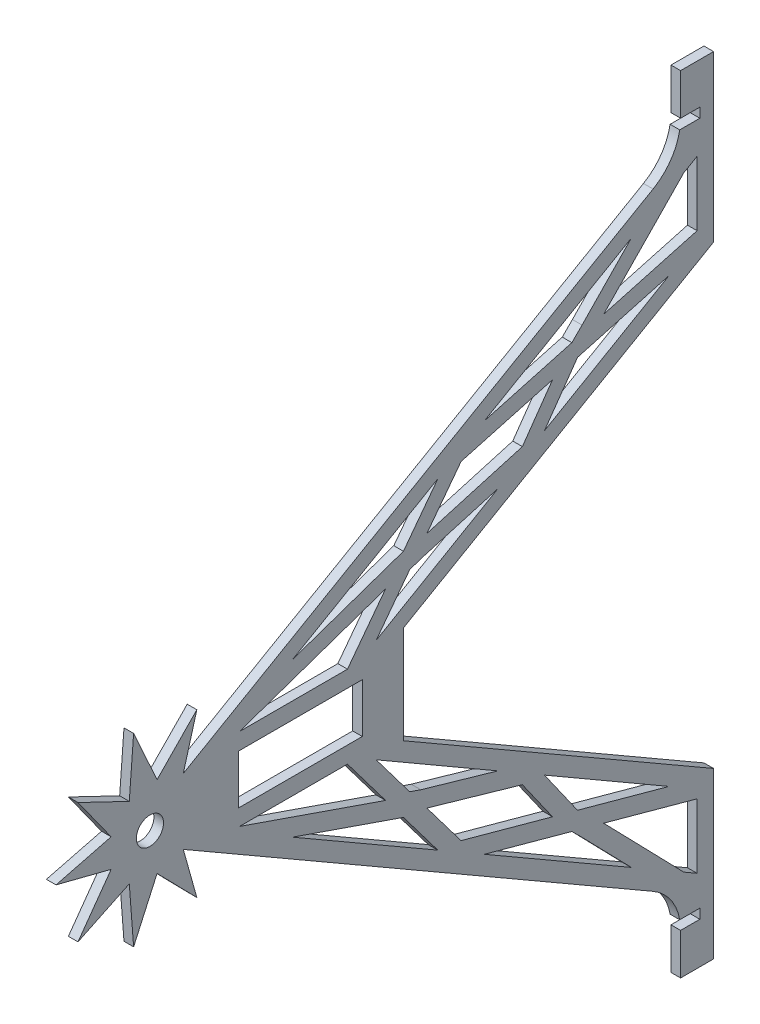
from build123d import *

# Parameters (mm, degrees)
SKETCH1_R               = 4.95
SKETCH1_W               = 17.9
SKETCH1_H               = 45.1
BOSS_EXTRUDE1_DEPTH     = 3.5
CUT_EXTRUDE1_DEPTH      = 251.796682357
CUT_EXTRUDE1_DEPTH_BACK = 251.796682357
SKETCH2_W               = 258.160615752
SKETCH2_H               = 10
SKETCH3_W               = 12
SKETCH3_H               = 60
BOSS_EXTRUDE2_DEPTH     = 3.5
FILLET1_R               = 20
BOSS_EXTRUDE3_START     = -3.5
BOSS_EXTRUDE3_DEPTH     = 3.5
CIRPATTERN1_COUNT       = 9
SKETCH5_W               = 17
SKETCH5_H               = 3.5
CUT_EXTRUDE2_DEPTH      = 250.910895112
CUT_EXTRUDE3_DEPTH      = 250.910895112


with BuildPart() as part:
    # Sketch1 → Boss-Extrude1 (new body)
    with BuildSketch(Plane.YZ):
        with BuildLine():
            Line((-10.899695646, -10.305175148), (-129.080307876, -215))
            Line((-129.080307876, -215), (-88.665789032, -215))
            Line((-88.665789032, -215), (-17.790269987, -92.24))
            Line((-17.790269987, -92.24), (17.790269987, -92.24))
            Line((17.790269987, -92.24), (88.665789032, -215))
            Line((88.665789032, -215), (129.080307876, -215))
            Line((129.080307876, -215), (10.899695646, -10.305175148))
            ThreePointArc((10.899695646, -10.305175148), (0, 15), (-10.899695646, -10.305175148))
        make_face()
        Circle(SKETCH1_R, mode=Mode.SUBTRACT)
        with Locations((0, -54.69)):
            Rectangle(SKETCH1_W, SKETCH1_H, mode=Mode.SUBTRACT)
    extrude(amount=BOSS_EXTRUDE1_DEPTH)

    # Sketch2 → Cut-Extrude1 (cut, two sides: drawn at the far end of the back side and taken through both)
    with BuildSketch(Plane.YZ.offset(3.5).offset(-CUT_EXTRUDE1_DEPTH_BACK)):
        with Locations((0, -210)):
            Rectangle(SKETCH2_W, SKETCH2_H)
    extrude(amount=CUT_EXTRUDE1_DEPTH + CUT_EXTRUDE1_DEPTH_BACK, mode=Mode.SUBTRACT)

    # Sketch3 → Boss-Extrude2 (add)
    with BuildSketch(Plane(origin=(3.5, 0, 0), x_dir=(0, 0, -1), z_dir=(1, 0, 0))):
        with Locations((199, -112.892286341)):
            Rectangle(SKETCH3_W, SKETCH3_H)
        with Locations((199, 112.892286341)):
            Rectangle(SKETCH3_W, SKETCH3_H)
    extrude(amount=-BOSS_EXTRUDE2_DEPTH)

    # Fillet1
    fillet1_edges = [part.edges().sort_by_distance(p)[0] for p in [
        (1.75, 116.378601954, -193),
        (1.75, -116.378601954, -193),
    ]]
    fillet(fillet1_edges, radius=FILLET1_R)

    # Sketch4 → Boss-Extrude3 (add)
    with BuildSketch(Plane(origin=(3.5, 0, 0), x_dir=(0, 0, -1), z_dir=(1, 0, 0)).offset(BOSS_EXTRUDE3_START)):
        with BuildLine():
            Line((-34.137962787, 0), (-14.095389312, -5.13030215))
            ThreePointArc((-14.095389312, -5.13030215), (-15, 0), (-14.095389312, 5.13030215))
            Line((-14.095389312, 5.13030215), (-34.137962787, 0))
        make_face()
    boss_extrude3 = extrude(amount=BOSS_EXTRUDE3_DEPTH)

    # CirPattern1: Boss-Extrude3 ×9 about axis
    cirpattern1_axis = Axis((-0.1751615, 0, 0), (1, 0, 0))
    for i in range(1, CIRPATTERN1_COUNT):
        add(boss_extrude3.rotate(cirpattern1_axis, i * 360 / CIRPATTERN1_COUNT))

    # Sketch5 → Cut-Extrude2 (cut, symmetric)
    with BuildSketch(Plane(origin=(3.5, 0, 0), x_dir=(0, 0, -1), z_dir=(1, 0, 0))):
        with Locations((191.5, -126.142286341)):
            Rectangle(SKETCH5_W, SKETCH5_H)
    cut_extrude2 = extrude(amount=CUT_EXTRUDE2_DEPTH, both=True, mode=Mode.SUBTRACT)

    # Mirror1: Cut-Extrude2 across plane
    add(cut_extrude2.mirror(Plane.ZX), mode=Mode.SUBTRACT)

    # Sketch6 → Cut-Extrude3 (cut, symmetric)
    with BuildSketch(Plane.YZ.offset(3.5)):
        Polygon((-44.440620352, -126.565865893), (-18.81339339, -82.279763058), (-34.966746745, -94.476691336), (-36.374058239, -98.54606889), align=None)
        Polygon((-33.320603167, -85.715441185), (-14.95, -71.844331927), (-14.95, -32.59506202), align=None)
        Polygon((-80.442842118, -188.780872527), (-54.234238638, -143.490099921), (-71.318419935, -155.512353255), align=None)
        Polygon((-41.912952433, -92.203274728), (-27.957868434, -51.850797102), (-58.475794969, -104.709396402), align=None)
        Polygon((-112.914500338, -199), (-89.467175046, -199), (-80.146284863, -165.015139537), (-110.110561046, -194.143434684), align=None)
        Polygon((-76.978433226, -153.464848336), (-68.249306861, -121.637615567), (-99.099637478, -175.071955626), (-80.672732205, -157.159147315), align=None)
        Polygon((-43.245914121, -100.728050325), (-59.700544534, -113.152464165), (-68.824966717, -146.420983438), (-53.243788825, -135.456403713), align=None)
    cut_extrude3 = extrude(amount=CUT_EXTRUDE3_DEPTH, both=True, mode=Mode.SUBTRACT)

    # Mirror2: Cut-Extrude3 across plane
    add(cut_extrude3.mirror(Plane.ZX), mode=Mode.SUBTRACT)


solid = part.part
